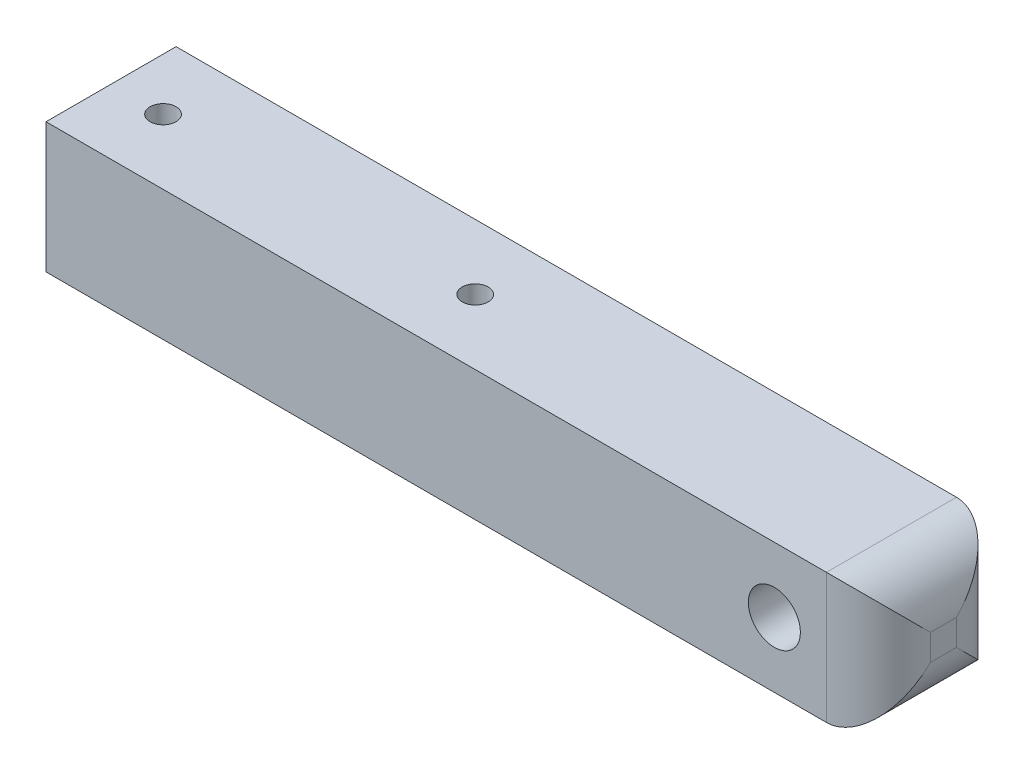
from build123d import *

# Parameters (mm, degrees)
BOSS_EXTRUDE1_DEPTH         = 15.875
CUT_EXTRUDE1_DEPTH          = 152.4
F_1_2_0_5_DIAMETER_HOLE1_D  = 12.7
F_1_4_0_25_DIAMETER_HOLE1_D = 6.35
FILLET1_R                   = 12.7


with BuildPart() as part:
    # Sketch1 → Boss-Extrude1 (new, symmetric)
    with BuildSketch(Plane.XY):
        Polygon((0, 0), (101.6, 0), (101.6, 31.75), (-101.6, 31.75), (-101.6, 0), align=None)
    extrude(amount=BOSS_EXTRUDE1_DEPTH, both=True)

    # Sketch2 → Cut-Extrude1 (cut)
    with BuildSketch(Plane.ZY.offset(101.6)):
        Polygon((0, 4.971051224), (-8.980256121, 13.951307345), (-9.878281733, 13.053281733), (0, 3.175), (9.878281733, 13.053281733), (8.980256121, 13.951307345), align=None)
    extrude(amount=-CUT_EXTRUDE1_DEPTH, mode=Mode.SUBTRACT)

    # 1/2 (0.5) Diameter Hole1 (through all)
    with Locations(Plane.XY.offset(15.875)):
        with Locations((76.2, 15.875)):
            Hole(F_1_2_0_5_DIAMETER_HOLE1_D / 2)

    # 1/4 (0.25) Diameter Hole1 (through all)
    with Locations(Plane(origin=(0, 31.75, 0), x_dir=(1, 0, 0), z_dir=(0, 1, 0))):
        with Locations((-88.9, 0), (-12.7, 0)):
            Hole(F_1_4_0_25_DIAMETER_HOLE1_D / 2)

    # Fillet1
    fillet1_edges = [part.edges().sort_by_distance(p)[0] for p in [
        (101.6, 15.875, 15.875),
        (101.6, 15.875, -15.875),
        (101.6, 31.75, 0),
        (101.6, 0, 0),
    ]]
    fillet(fillet1_edges, radius=FILLET1_R)


solid = part.part
